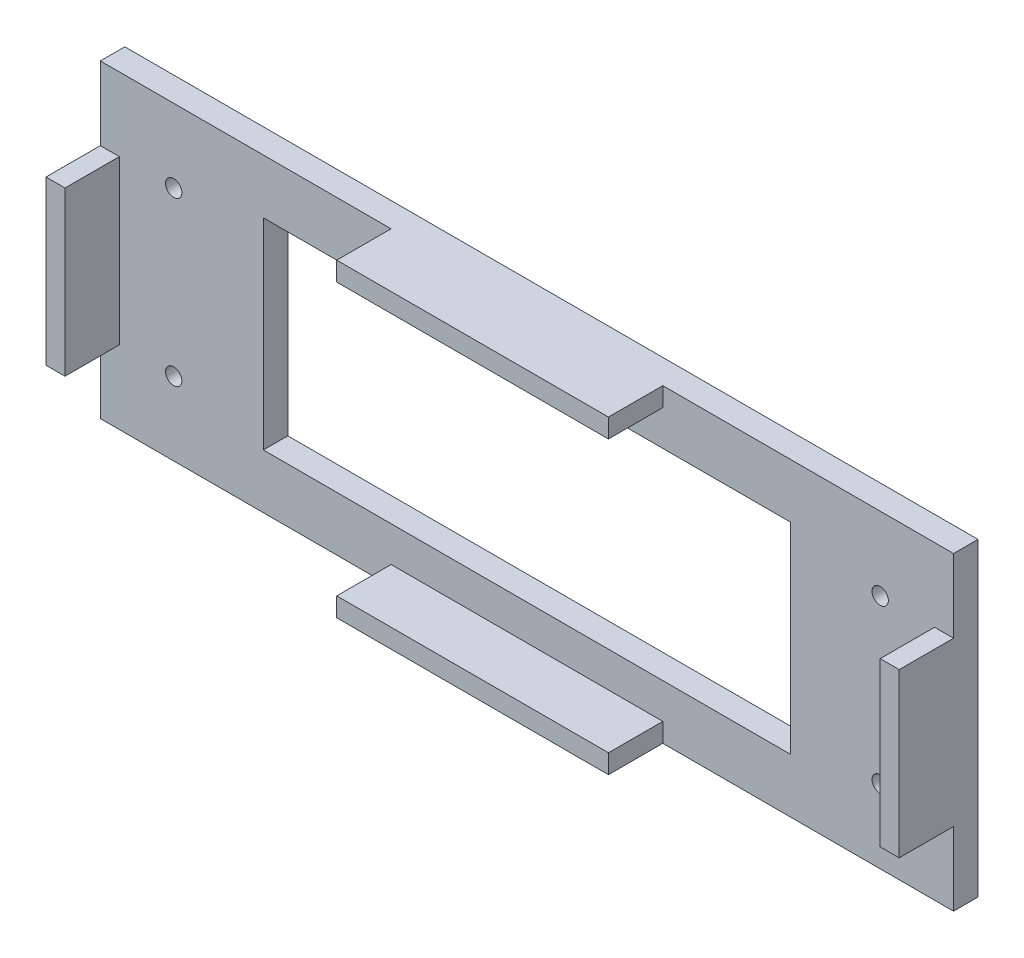
from build123d import *

# Parameters (mm, degrees)
SKETCH_1_W      = 157
SKETCH_1_H      = 57
SKETCH_1_R      = 1.5
SKETCH_1_W_2    = 97
SKETCH_1_H_2    = 37
EXTRUDE_1_DEPTH = 4.5
SKETCH_2_W      = 3.5
SKETCH_2_H      = 30
SKETCH_2_W_2    = 50
SKETCH_2_H_2    = 3.5
EXTRUDE_2_DEPTH = 10


with BuildPart() as part:
    # 草图1 → 凸台-拉伸1 (new body)
    with BuildSketch(Plane.XY):
        Rectangle(SKETCH_1_W, SKETCH_1_H)
        with Locations((-65, 15)):
            Circle(SKETCH_1_R, mode=Mode.SUBTRACT)
        with Locations((65, 15)):
            Circle(SKETCH_1_R, mode=Mode.SUBTRACT)
        with Locations((-65, -15)):
            Circle(SKETCH_1_R, mode=Mode.SUBTRACT)
        with Locations((65, -15)):
            Circle(SKETCH_1_R, mode=Mode.SUBTRACT)
        Rectangle(SKETCH_1_W_2, SKETCH_1_H_2, mode=Mode.SUBTRACT)
    extrude(amount=EXTRUDE_1_DEPTH)

    # 草图2 → 凸台-拉伸2 (add)
    with BuildSketch(Plane.XY.offset(4.5)):
        with Locations((-76.75, 0)):
            Rectangle(SKETCH_2_W, SKETCH_2_H)
        with Locations((76.75, 0)):
            Rectangle(SKETCH_2_W, SKETCH_2_H)
        with Locations((0, 26.75)):
            Rectangle(SKETCH_2_W_2, SKETCH_2_H_2)
        with Locations((0, -26.75)):
            Rectangle(SKETCH_2_W_2, SKETCH_2_H_2)
    extrude(amount=EXTRUDE_2_DEPTH)


solid = part.part
